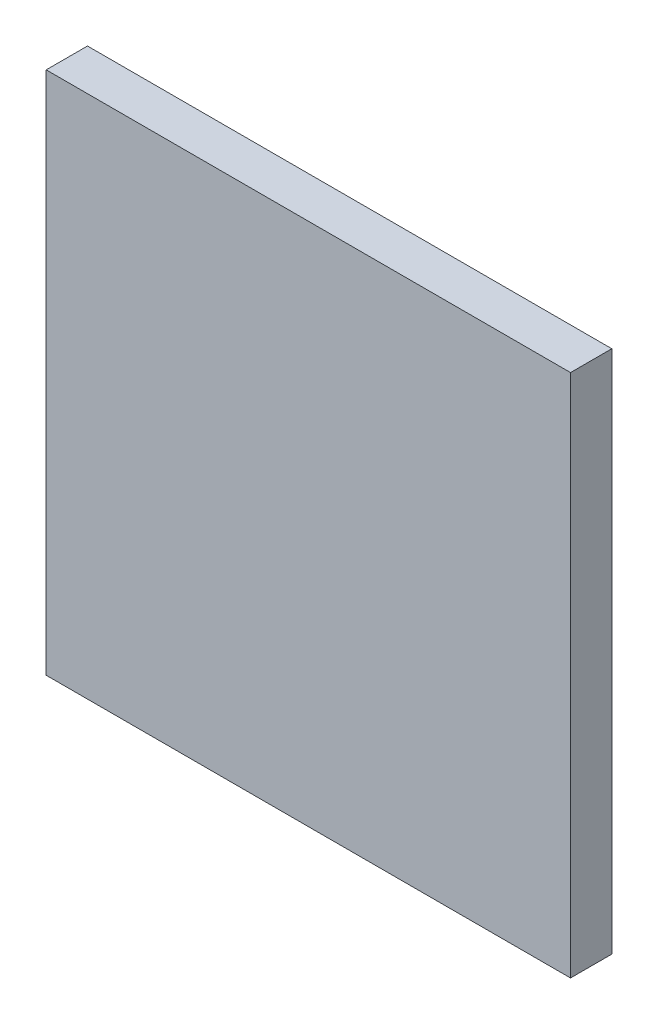
from build123d import *

# Parameters (mm, degrees)
SKETCH1_W           = 50.8
SKETCH1_H           = 50.8
BOSS_EXTRUDE1_DEPTH = 4


with BuildPart() as part:
    # Sketch1 → Boss-Extrude1 (new body)
    with BuildSketch(Plane.XY):
        with Locations((-25.4, 25.4)):
            Rectangle(SKETCH1_W, SKETCH1_H)
    extrude(amount=BOSS_EXTRUDE1_DEPTH)


solid = part.part
